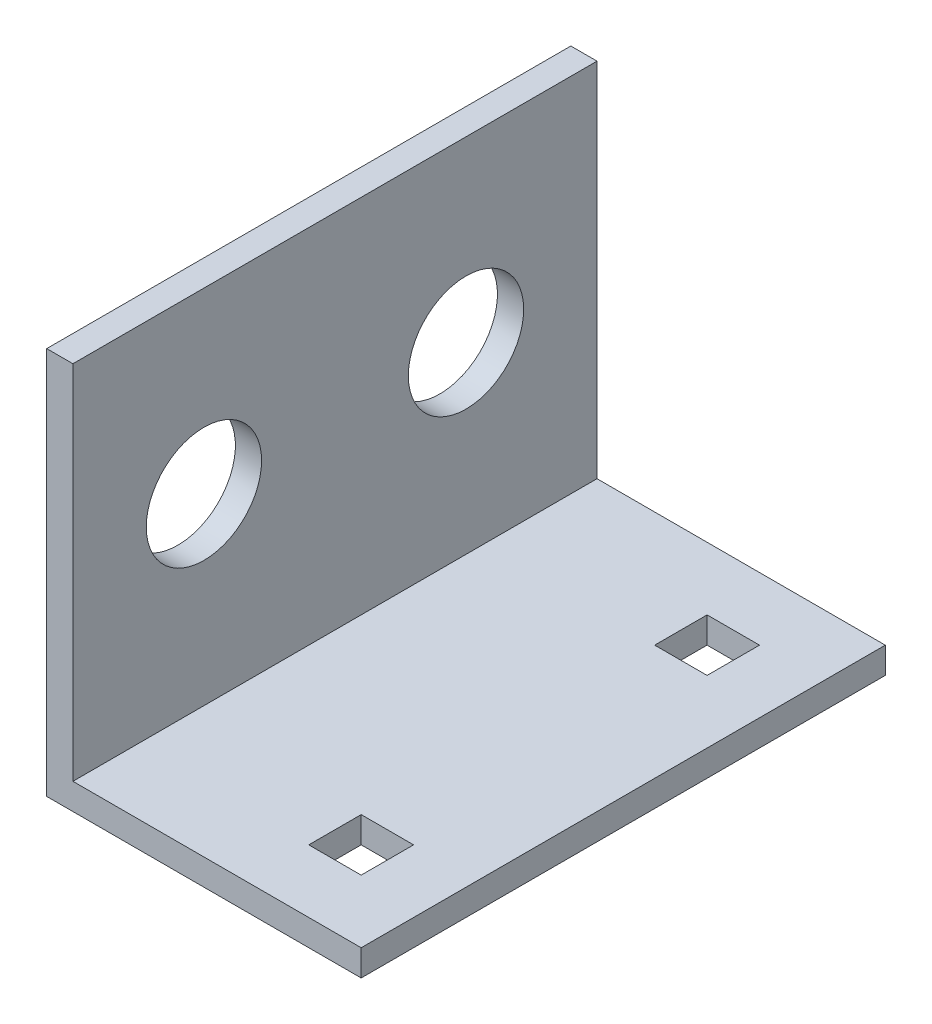
from build123d import *

# Parameters (mm, degrees)
BOSS_EXTRUDE1_DEPTH = 50
SKETCH2_R           = 5.5
CUT_EXTRUDE1_DEPTH  = 70.057946682
SKETCH3_W           = 5
SKETCH3_H           = 5
CUT_EXTRUDE2_DEPTH  = 50


with BuildPart() as part:
    # Sketch1 → Boss-Extrude1 (new body)
    with BuildSketch(Plane.XY):
        Polygon((0, 4.805194805), (0, 0), (4.805194805, 0), (30, 0), (30, 2.5), (2.5, 2.5), (2.5, 37), (0, 37), align=None)
    extrude(amount=-BOSS_EXTRUDE1_DEPTH)

    # Sketch2 → Cut-Extrude1 (cut, through all)
    with BuildSketch(Plane.ZY):
        with Locations((-37.5, 20)):
            Circle(SKETCH2_R)
        with Locations((-12.5, 20)):
            Circle(SKETCH2_R)
    extrude(amount=-CUT_EXTRUDE1_DEPTH, mode=Mode.SUBTRACT)

    # Sketch3 → Cut-Extrude2 (cut)
    with BuildSketch(Plane.XZ):
        with Locations((21.5, -8.5)):
            Rectangle(SKETCH3_W, SKETCH3_H)
        with Locations((21.5, -41.5)):
            Rectangle(SKETCH3_W, SKETCH3_H)
    extrude(amount=-CUT_EXTRUDE2_DEPTH, mode=Mode.SUBTRACT)


solid = part.part
